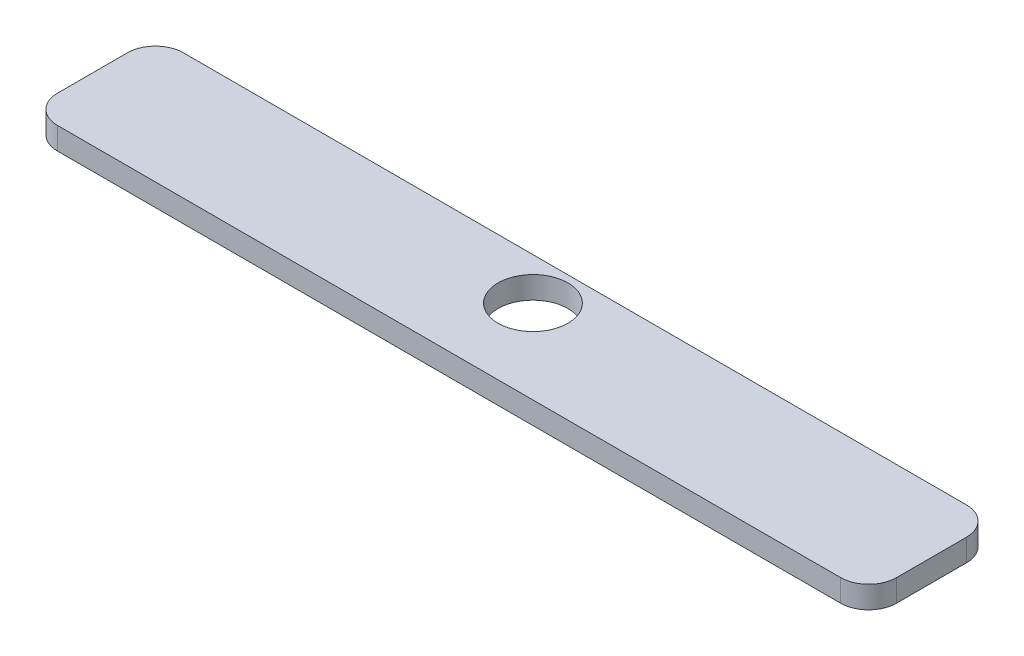
from build123d import *

# Parameters (mm, degrees)
SKETCH1_W           = 30
SKETCH1_H           = 4.5
SKETCH1_R           = 1.25
BOSS_EXTRUDE1_DEPTH = 0.79375
FILLET1_R           = 1


with BuildPart() as part:
    # Sketch1 → Boss-Extrude1 (new body)
    with BuildSketch(Plane(origin=(0, 0, 0), x_dir=(1, 0, 0), z_dir=(0, 1, 0))):
        with Locations((15, 2.25)):
            Rectangle(SKETCH1_W, SKETCH1_H)
        with Locations(Location((15, 3, 0), (0, 0, 270))):
            Circle(SKETCH1_R, mode=Mode.SUBTRACT)
    extrude(amount=BOSS_EXTRUDE1_DEPTH)

    # Fillet1
    fillet1_edges = [part.edges().sort_by_distance(p)[0] for p in [
        (0, 0.396875, -4.5),
        (30, 0.396875, -4.5),
        (30, 0.396875, 0),
        (0, 0.396875, 0),
    ]]
    fillet(fillet1_edges, radius=FILLET1_R)


solid = part.part
